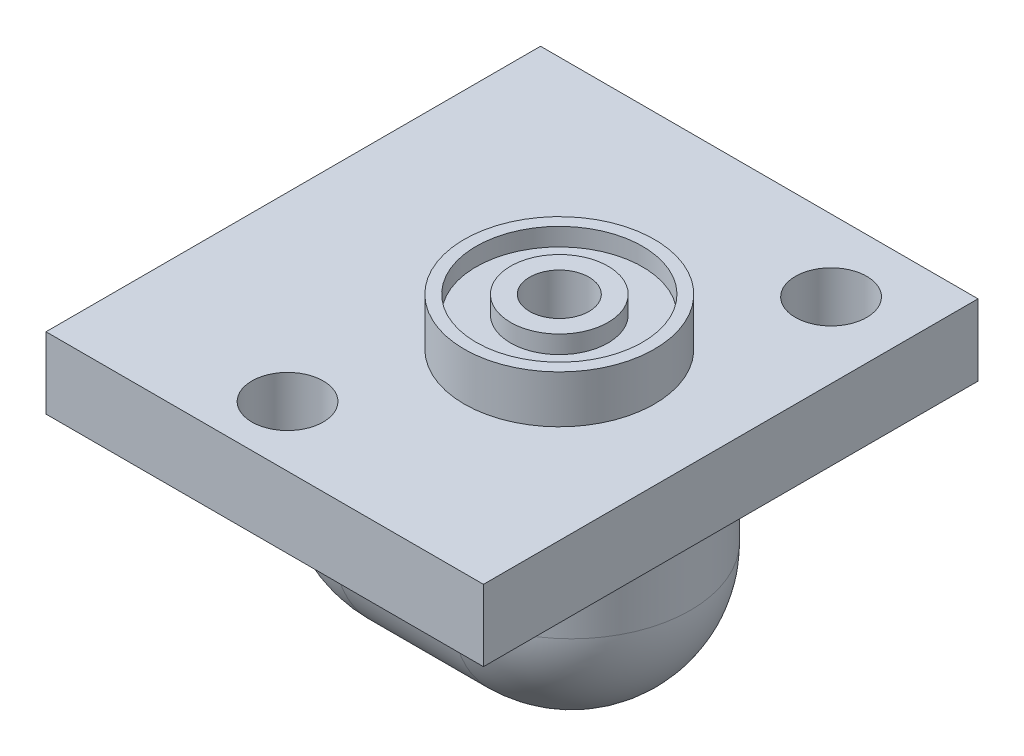
from build123d import *

# Parameters (mm, degrees)
REVOLVE1_ANGLE                  = 180
BOSS_EXTRUDE2_DEPTH             = 4
BOSS_EXTRUDE4_DEPTH             = 3
SKETCH12_R                      = 4
BOSS_EXTRUDE5_DEPTH             = 2
CUT_EXTRUDE2_REACH              = 100.408
SKETCH13_R                      = 1.25
SKETCH14_R                      = 3.5
SKETCH14_R_2                    = 2.05
CUT_EXTRUDE3_DEPTH              = 0.75
F_1_4_0_25_DIAMETER_HOLE1_D     = 6.35
F_1_4_0_25_DIAMETER_HOLE1_DEPTH = 4
F_1_4_0_25_DIAMETER_HOLE1_TIP   = 1.907732465


with BuildPart() as part:
    # Sketch2 → Revolve1 (revolve)
    with BuildSketch(Plane(origin=(0, 0, 0), x_dir=(1, 0, 0), z_dir=(0, 1, 0))):
        with BuildLine():
            Line((79.585159762, 39.800683112), (74.585159762, 39.800683112))
            ThreePointArc((74.585159762, 39.800683112), (71.049625856, 38.336217018), (69.585159762, 34.800683112))
            Line((69.585159762, 34.800683112), (71.085159762, 34.800683112))
            ThreePointArc((71.085159762, 34.800683112), (72.110286027, 37.275556846), (74.585159762, 38.300683112))
            Line((74.585159762, 38.300683112), (79.585159762, 38.300683112))
            ThreePointArc((79.585159762, 38.300683112), (82.060033496, 37.275556846), (83.085159762, 34.800683112))
            Line((83.085159762, 34.800683112), (84.585159762, 34.800683112))
            ThreePointArc((84.585159762, 34.800683112), (83.120693668, 38.336217018), (79.585159762, 39.800683112))
        make_face()
    revolve(axis=Axis((74.585159762, 0, -34.800683112), (-1, 0, 0)), revolution_arc=REVOLVE1_ANGLE)

    # Sketch7 → Boss-Extrude2 (add)
    with BuildSketch(Plane(origin=(0, 0, 0), x_dir=(1, 0, 0), z_dir=(0, 1, 0))):
        with BuildLine():
            Line((74.585159762, 39.800683112), (79.585159762, 39.800683112))
            ThreePointArc((79.585159762, 39.800683112), (83.120693668, 38.336217018), (84.585159762, 34.800683112))
            ThreePointArc((84.585159762, 34.800683112), (83.120693668, 31.265149206), (79.585159762, 29.800683112))
            Line((79.585159762, 29.800683112), (74.585159762, 29.800683112))
            ThreePointArc((74.585159762, 29.800683112), (71.049625856, 31.265149206), (69.585159762, 34.800683112))
            ThreePointArc((69.585159762, 34.800683112), (71.049625856, 38.336217018), (74.585159762, 39.800683112))
        make_face()
        with BuildLine():
            Line((74.585159762, 38.300683112), (79.585159762, 38.300683112))
            ThreePointArc((79.585159762, 38.300683112), (82.060033496, 37.275556846), (83.085159762, 34.800683112))
            ThreePointArc((83.085159762, 34.800683112), (82.060033496, 32.325809378), (79.585159762, 31.300683112))
            Line((79.585159762, 31.300683112), (74.585159762, 31.300683112))
            ThreePointArc((74.585159762, 31.300683112), (72.110286027, 32.325809378), (71.085159762, 34.800683112))
            ThreePointArc((71.085159762, 34.800683112), (72.110286027, 37.275556846), (74.585159762, 38.300683112))
        make_face(mode=Mode.SUBTRACT)
    extrude(amount=BOSS_EXTRUDE2_DEPTH)

    # Sketch8 → Boss-Extrude4 (add)
    with BuildSketch(Plane(origin=(0, 4, 0), x_dir=(1, 0, 0), z_dir=(0, 1, 0))):
        with BuildLine():
            Line((86.285159762, 45.200683112), (67.885159762, 45.200683112))
            Line((67.885159762, 45.200683112), (67.885159762, 42.180683112))
            Line((67.885159762, 42.180683112), (81.625159762, 42.180683112))
            ThreePointArc((81.625159762, 42.180683112), (83.125159762, 43.680683112), (84.625159762, 42.180683112))
            ThreePointArc((84.625159762, 42.180683112), (84.185819933, 41.12002294), (83.125159762, 40.680683112))
            Line((83.125159762, 40.680683112), (83.125159762, 38.331745275))
            ThreePointArc((83.125159762, 38.331745275), (84.585159762, 34.800683112), (83.125159762, 31.269620949))
            Line((83.125159762, 31.269620949), (83.125159762, 24.400683112))
            Line((83.125159762, 24.400683112), (86.285159762, 24.400683112))
            Line((86.285159762, 24.400683112), (86.285159762, 45.200683112))
        make_face()
        with BuildLine():
            Line((81.625159762, 42.180683112), (67.885159762, 42.180683112))
            Line((67.885159762, 42.180683112), (67.885159762, 34.560683112))
            Line((67.885159762, 34.560683112), (69.590923083, 34.560683112))
            ThreePointArc((69.590923083, 34.560683112), (70.965767547, 38.250320774), (74.585159762, 39.800683112))
            Line((74.585159762, 39.800683112), (79.585159762, 39.800683112))
            ThreePointArc((79.585159762, 39.800683112), (81.501496004, 39.418870571), (83.125159762, 38.331745275))
            Line((83.125159762, 38.331745275), (83.125159762, 40.680683112))
            ThreePointArc((83.125159762, 40.680683112), (82.06449959, 41.12002294), (81.625159762, 42.180683112))
        make_face()
        with BuildLine():
            ThreePointArc((74.585159762, 39.800683112), (70.965767547, 38.250320774), (69.590923083, 34.560683112))
            Line((69.590923083, 34.560683112), (71.093398029, 34.560683112))
            ThreePointArc((71.093398029, 34.560683112), (72.02684, 37.189197295), (74.585159762, 38.300683112))
            Line((74.585159762, 38.300683112), (79.585159762, 38.300683112))
            ThreePointArc((79.585159762, 38.300683112), (83.085159762, 34.800683112), (79.585159762, 31.300683112))
            Line((79.585159762, 31.300683112), (79.315159762, 31.300683112))
            Line((79.315159762, 31.300683112), (79.315159762, 29.800683112))
            Line((79.315159762, 29.800683112), (79.585159762, 29.800683112))
            ThreePointArc((79.585159762, 29.800683112), (81.501496004, 30.182495653), (83.125159762, 31.269620949))
            Line((83.125159762, 31.269620949), (83.125159762, 38.331745275))
            ThreePointArc((83.125159762, 38.331745275), (81.501496004, 39.418870571), (79.585159762, 39.800683112))
            Line((79.585159762, 39.800683112), (74.585159762, 39.800683112))
        make_face()
        with BuildLine():
            Line((83.125159762, 38.331745275), (83.125159762, 31.269620949))
            ThreePointArc((83.125159762, 31.269620949), (84.585159762, 34.800683112), (83.125159762, 38.331745275))
        make_face()
        with BuildLine():
            ThreePointArc((74.585159762, 38.300683112), (72.02684, 37.189197295), (71.093398029, 34.560683112))
            Line((71.093398029, 34.560683112), (79.315159762, 34.560683112))
            Line((79.315159762, 34.560683112), (79.315159762, 31.300683112))
            Line((79.315159762, 31.300683112), (79.585159762, 31.300683112))
            ThreePointArc((79.585159762, 31.300683112), (83.085159762, 34.800683112), (79.585159762, 38.300683112))
            Line((79.585159762, 38.300683112), (74.585159762, 38.300683112))
        make_face()
        with BuildLine():
            Line((71.093398029, 34.560683112), (69.590923083, 34.560683112))
            ThreePointArc((69.590923083, 34.560683112), (71.135522099, 31.181290898), (74.585159762, 29.800683112))
            Line((74.585159762, 29.800683112), (79.315159762, 29.800683112))
            Line((79.315159762, 29.800683112), (79.315159762, 31.300683112))
            Line((79.315159762, 31.300683112), (74.585159762, 31.300683112))
            ThreePointArc((74.585159762, 31.300683112), (72.196645579, 32.242363351), (71.093398029, 34.560683112))
        make_face()
        with BuildLine():
            Line((79.315159762, 34.560683112), (71.093398029, 34.560683112))
            ThreePointArc((71.093398029, 34.560683112), (72.196645579, 32.242363351), (74.585159762, 31.300683112))
            Line((74.585159762, 31.300683112), (79.315159762, 31.300683112))
            Line((79.315159762, 31.300683112), (79.315159762, 34.560683112))
        make_face()
        with BuildLine():
            Line((74.005159762, 26.940683112), (67.885159762, 26.940683112))
            Line((67.885159762, 26.940683112), (67.885159762, 24.400683112))
            Line((67.885159762, 24.400683112), (75.505159762, 24.400683112))
            Line((75.505159762, 24.400683112), (75.505159762, 25.440683112))
            ThreePointArc((75.505159762, 25.440683112), (74.44449959, 25.88002294), (74.005159762, 26.940683112))
        make_face()
        with BuildLine():
            Line((79.315159762, 24.400683112), (83.125159762, 24.400683112))
            Line((83.125159762, 24.400683112), (83.125159762, 31.269620949))
            ThreePointArc((83.125159762, 31.269620949), (81.501496004, 30.182495653), (79.585159762, 29.800683112))
            Line((79.585159762, 29.800683112), (79.315159762, 29.800683112))
            Line((79.315159762, 29.800683112), (79.315159762, 24.400683112))
        make_face()
        with BuildLine():
            Line((69.590923083, 34.560683112), (67.885159762, 34.560683112))
            Line((67.885159762, 34.560683112), (67.885159762, 26.940683112))
            Line((67.885159762, 26.940683112), (74.005159762, 26.940683112))
            ThreePointArc((74.005159762, 26.940683112), (75.505159762, 28.440683112), (77.005159762, 26.940683112))
            ThreePointArc((77.005159762, 26.940683112), (76.565819933, 25.88002294), (75.505159762, 25.440683112))
            Line((75.505159762, 25.440683112), (75.505159762, 24.400683112))
            Line((75.505159762, 24.400683112), (79.315159762, 24.400683112))
            Line((79.315159762, 24.400683112), (79.315159762, 29.800683112))
            Line((79.315159762, 29.800683112), (74.585159762, 29.800683112))
            ThreePointArc((74.585159762, 29.800683112), (71.135522099, 31.181290898), (69.590923083, 34.560683112))
        make_face()
    extrude(amount=BOSS_EXTRUDE4_DEPTH)

    # Sketch12 → Boss-Extrude5 (add)
    with BuildSketch(Plane(origin=(0, 7, 0), x_dir=(1, 0, 0), z_dir=(0, 1, 0))):
        with Locations(Location((79.315159762, 34.560683112, 0), (0, 0, 270))):
            Circle(SKETCH12_R)
    extrude(amount=BOSS_EXTRUDE5_DEPTH)

    # Sketch13 → Cut-Extrude2 (cut, up to next)
    with BuildSketch(Plane(origin=(0, 9, 0), x_dir=(1, 0, 0), z_dir=(0, 1, 0)), mode=Mode.PRIVATE) as cut_extrude2_sk1:
        with Locations(Location((79.315159762, 34.560683112, 0), (0, 0, 270))):
            Circle(SKETCH13_R)
    cut_extrude2_tool1 = extrude(cut_extrude2_sk1.sketch, amount=-CUT_EXTRUDE2_REACH, mode=Mode.PRIVATE) & part.part
    add(cut_extrude2_tool1.solids().sort_by_distance((79.31516, 9, -34.560683))[0], mode=Mode.SUBTRACT)

    # Sketch14 → Cut-Extrude3 (cut)
    with BuildSketch(Plane(origin=(0, 9, 0), x_dir=(1, 0, 0), z_dir=(0, 1, 0))):
        with Locations(Location((79.315159762, 34.560683112, 0), (0, 0, 270))):
            Circle(SKETCH14_R)
        with Locations(Location((79.315159762, 34.560683112, 0), (0, 0, 270))):
            Circle(SKETCH14_R_2, mode=Mode.SUBTRACT)
    extrude(amount=-CUT_EXTRUDE3_DEPTH, mode=Mode.SUBTRACT)

    # 1/4 (0.25) Diameter Hole1
    with Locations(Plane(origin=(77.057625156, -5, -34.800683112), x_dir=(0, 0, -1), z_dir=(0, -1, 0))):
        with Locations((0, 0)):
            Hole(F_1_4_0_25_DIAMETER_HOLE1_D / 2, depth=F_1_4_0_25_DIAMETER_HOLE1_DEPTH)
            with Locations((0, 0, -(F_1_4_0_25_DIAMETER_HOLE1_DEPTH + F_1_4_0_25_DIAMETER_HOLE1_TIP / 2))):  # 118° drill point
                Cone(0, F_1_4_0_25_DIAMETER_HOLE1_D / 2, F_1_4_0_25_DIAMETER_HOLE1_TIP, mode=Mode.SUBTRACT)


solid = part.part
